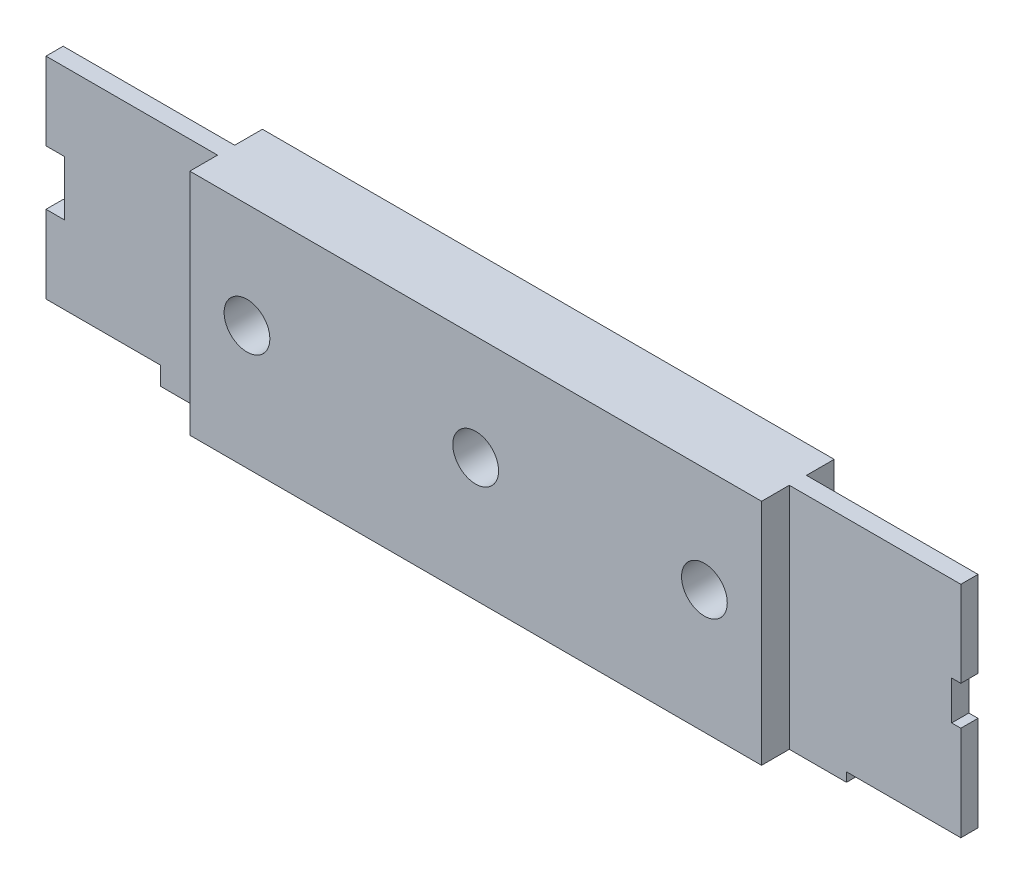
from build123d import *

# Parameters (mm, degrees)
CROQUIS1_R              = 2
SALIENTE_EXTRUIR1_DEPTH = 0.75
CROQUIS2_W              = 50
CROQUIS2_H              = 20
CROQUIS2_R              = 2
SALIENTE_EXTRUIR2_DEPTH = 3.175


with BuildPart() as part:
    # Croquis1 → Saliente-Extruir1 (new, symmetric)
    with BuildSketch(Plane.XY):
        Polygon((-40, 9.2), (40, 9.2), (40, 1.7), (39.2, 1.7), (39.2, -1.7), (40, -1.7), (40, -10), (30, -10), (30, -10.8), (-30, -10.8), (-30, -9.2), (-40, -9.2), (-40, -2.4), (-38.4, -2.4), (-38.4, 2.4), (-40, 2.4), align=None)
        with Locations((20, 0)):
            Circle(CROQUIS1_R, mode=Mode.SUBTRACT)
        Circle(CROQUIS1_R, mode=Mode.SUBTRACT)
        with Locations((-20, 0)):
            Circle(CROQUIS1_R, mode=Mode.SUBTRACT)
    extrude(amount=SALIENTE_EXTRUIR1_DEPTH, both=True)

    # Croquis2 → Saliente-Extruir2 (add, symmetric)
    with BuildSketch(Plane.XY):
        with Locations((0, -0.8)):
            Rectangle(CROQUIS2_W, CROQUIS2_H)
        with Locations((-20, 0)):
            Circle(CROQUIS2_R, mode=Mode.SUBTRACT)
        Circle(CROQUIS2_R, mode=Mode.SUBTRACT)
        with Locations((20, 0)):
            Circle(CROQUIS2_R, mode=Mode.SUBTRACT)
    extrude(amount=SALIENTE_EXTRUIR2_DEPTH, both=True)


solid = part.part
